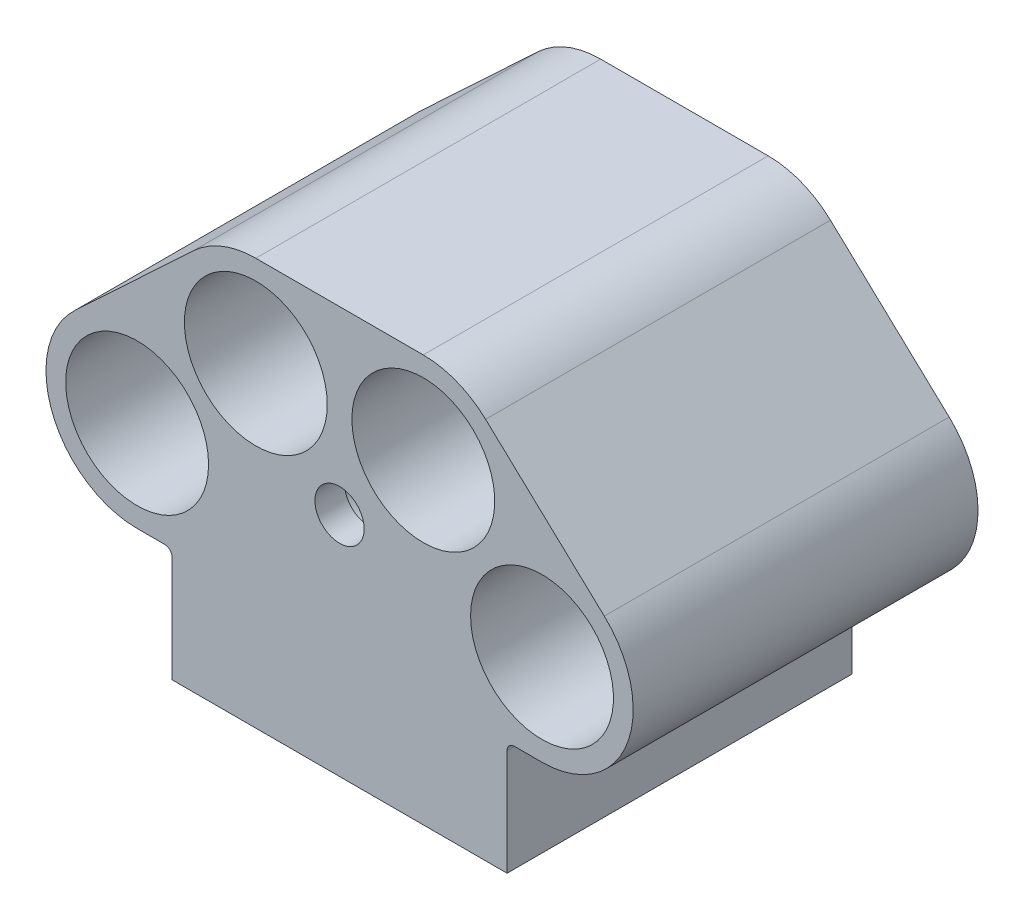
from build123d import *

# Parameters (mm, degrees)
SKETCH1_R           = 7.25
BOSS_EXTRUDE1_DEPTH = 17.5
SKETCH2_R           = 2.5
CUT_EXTRUDE1_DEPTH  = 61.478337768
CUT_EXTRUDE2_START  = -32
SKETCH3_R           = 4
CUT_EXTRUDE2_DEPTH  = 29


with BuildPart() as part:
    # Sketch1 → Boss-Extrude1 (new, symmetric)
    with BuildSketch(Plane.XY):
        with BuildLine():
            ThreePointArc((-20.545709694, 9.528396762), (-29.148813935, 15.380000463), (-26.867170799, 25.531294621))
            Line((-26.867170799, 25.531294621), (-14.821461106, 36.807414431))
            ThreePointArc((-14.821461106, 36.807414431), (-11.898396299, 38.657620814), (-8.5, 39.304516572))
            Line((-8.5, 39.304516572), (0, 39.304516572))
            Line((0, 39.304516572), (0, -2))
            Line((0, -2), (-17, -2))
            Line((-17, -2), (-17, 8.778396762))
            ThreePointArc((-17, 8.778396762), (-17.219669914, 9.308726848), (-17.75, 9.528396762))
            Line((-17.75, 9.528396762), (-20.545709694, 9.528396762))
        make_face()
        with Locations((-8.5, 30.054516572)):
            Circle(SKETCH1_R, mode=Mode.SUBTRACT)
        with Locations((-20.545709694, 18.778396762)):
            Circle(SKETCH1_R, mode=Mode.SUBTRACT)
    boss_extrude1 = extrude(amount=BOSS_EXTRUDE1_DEPTH, both=True)

    # Mirror1: Boss-Extrude1 across plane
    add(boss_extrude1.mirror(Plane(origin=(0, 0, 0), x_dir=(0, 0, 1), z_dir=(1, 0, 0))))

    # Sketch2 → Cut-Extrude1 (cut, through all)
    with BuildSketch(Plane(origin=(0, 0, -17.5), x_dir=(-1, 0, 0), z_dir=(0, 0, -1))):
        with Locations((0, 21)):
            Circle(SKETCH2_R)
    extrude(amount=-CUT_EXTRUDE1_DEPTH, mode=Mode.SUBTRACT)

    # Sketch3 → Cut-Extrude2 (cut)
    with BuildSketch(Plane(origin=(0, 0, -17.5), x_dir=(-1, 0, 0), z_dir=(0, 0, -1)).offset(CUT_EXTRUDE2_START)):
        with Locations((0, 21)):
            Circle(SKETCH3_R)
    extrude(amount=CUT_EXTRUDE2_DEPTH, mode=Mode.SUBTRACT)


solid = part.part
